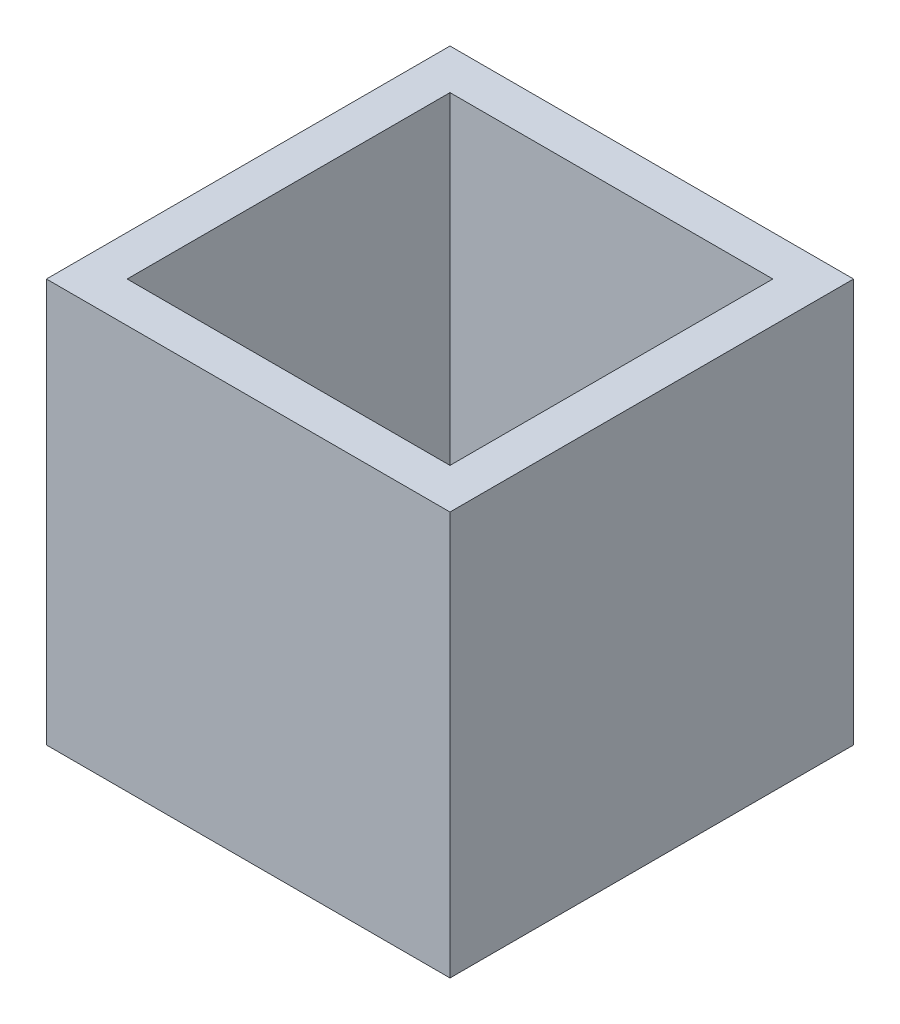
from build123d import *

# Parameters (mm, degrees)
SKETCH1_W           = 2.5
SKETCH1_H           = 2.5
SKETCH1_W_2         = 2
SKETCH1_H_2         = 2
BOSS_EXTRUDE1_DEPTH = 2.5
SCALE1_SCALE        = 6


with BuildPart() as part:
    # Sketch1 → Boss-Extrude1 (new body)
    with BuildSketch(Plane(origin=(0, 0, 0), x_dir=(1, 0, 0), z_dir=(0, 1, 0))):
        Rectangle(SKETCH1_W, SKETCH1_H)
        Rectangle(SKETCH1_W_2, SKETCH1_H_2, mode=Mode.SUBTRACT)
    extrude(amount=BOSS_EXTRUDE1_DEPTH)


with BuildPart() as part_1:
    # Scale1: scaled about (0, 1.25, 0)
    add(part.part.scale(SCALE1_SCALE).moved(Location((0, -6.25, 0))))


solid = part_1.part
